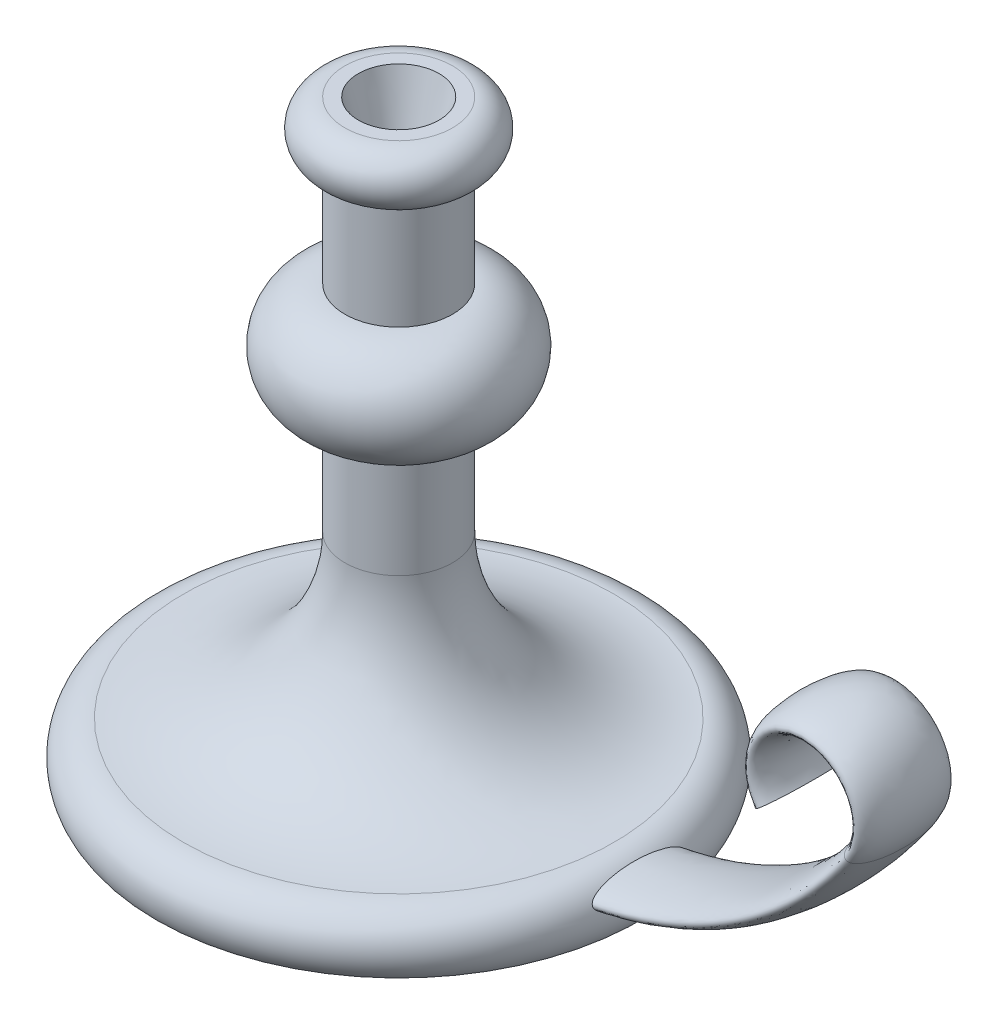
from build123d import *

# Parameters (mm, degrees)
SKETCH3_RX         = 17.5
SKETCH3_RY         = 5
SKETCH4_R          = 15
CUT_EXTRUDE1_DEPTH = 25
CUT_EXTRUDE1_DRAFT = -15


with BuildPart() as part:
    # Sketch1 → Revolve2 (revolve)
    with BuildSketch(Plane.XY, mode=Mode.PRIVATE) as revolve2_sk:
        with BuildLine():
            ThreePointArc((80, 20), (91.180339887, 13.090169944), (90, 0))
            Line((90, 0), (0, 0))
            Line((0, 0), (0, 220))
            Line((0, 220), (20, 220))
            ThreePointArc((20, 220), (30, 210), (20, 200))
            Line((20, 200), (20, 160))
            ThreePointArc((20, 160), (40, 140), (20, 120))
            Line((20, 120), (20, 80))
            ThreePointArc((20, 80), (37.573593129, 37.573593129), (80, 20))
        make_face()
    revolve(revolve2_sk.sketch.rotate(Axis((0, 0, 0), (0, 1, 0)), 90), axis=Axis((0, 0, 0), (0, 1, 0)))

    # Sweep1: sweep along a path in Sketch2
    with BuildLine(Plane.XY) as sweep1_path:
        Line((0, 10), (60, 10))
        ThreePointArc((60, 10), (129.821200219, 27.240819526), (183.592070943, 75))
        ThreePointArc((183.592070943, 75), (167.113128151, 106.333333333), (150.634185358, 75))
    # Sketch3 → Sweep1 (sweep)
    with BuildSketch(Plane(origin=(0, 0, 0), x_dir=(0, 0, -1), z_dir=(1, 0, 0))):
        with Locations((0, 10)):
            Ellipse(SKETCH3_RX, SKETCH3_RY)
    sweep(path=sweep1_path.line)


with BuildPart() as cut_extrude1_tool:
    # Sketch4 → Cut-Extrude1 (with draft: the straight prism first)
    with BuildSketch(Plane(origin=(0, 220, 0), x_dir=(1, 0, 0), z_dir=(0, 1, 0))):
        Circle(SKETCH4_R)
    extrude(amount=-CUT_EXTRUDE1_DEPTH)
    # Cut-Extrude1: the draft: its side faces are tilted about the plane it starts from
    cut_extrude1_sides = [cut_extrude1_tool.faces().sort_by_distance(p)[0] for p in [
        (-15, 207.5, 0),
    ]]
    draft(cut_extrude1_sides, Plane(origin=(0, 220, 0), x_dir=(1, 0, 0), z_dir=(0, 1, 0)), CUT_EXTRUDE1_DRAFT)


with BuildPart() as part_1:
    add(part.part)

    # Cut-Extrude1: cut by cut_extrude1_tool
    add(cut_extrude1_tool.part, mode=Mode.SUBTRACT)


solid = part_1.part
